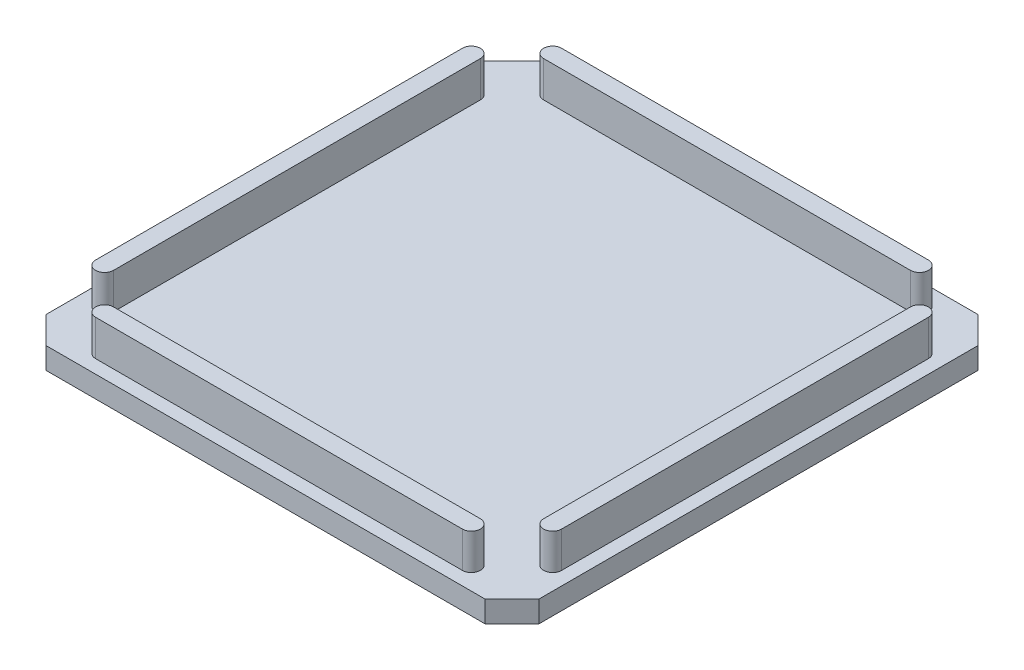
from build123d import *

# Parameters (mm, degrees)
BOSS_EXTRUDE1_DEPTH = 2.4
BOSS_EXTRUDE2_DEPTH = 4


with BuildPart() as part:
    # Sketch1 → Boss-Extrude1 (new body)
    with BuildSketch(Plane(origin=(0, 0, 0), x_dir=(1, 0, 0), z_dir=(0, 1, 0))):
        Polygon((-27.5, 24.5), (-24.5, 27.5), (24.5, 27.5), (27.5, 24.5), (27.5, -24.5), (24.5, -27.5), (-24.5, -27.5), (-27.5, -24.5), align=None)
    extrude(amount=BOSS_EXTRUDE1_DEPTH)

    # Sketch2 → Boss-Extrude2 (add)
    with BuildSketch(Plane(origin=(0, 2.4, 0), x_dir=(1, 0, 0), z_dir=(0, 1, 0))):
        with BuildLine():
            Line((-24, -20.465570271), (-24, 20.465570271))
            ThreePointArc((-24, 20.465570271), (-25, 21.465570271), (-26, 20.465570271))
            Line((-26, 20.465570271), (-26, -20.465570271))
            ThreePointArc((-26, -20.465570271), (-25, -21.465570271), (-24, -20.465570271))
        make_face()
        with BuildLine():
            Line((-20.465570271, 24), (20.465570271, 24))
            ThreePointArc((20.465570271, 24), (21.465570271, 25), (20.465570271, 26))
            Line((20.465570271, 26), (-20.465570271, 26))
            ThreePointArc((-20.465570271, 26), (-21.465570271, 25), (-20.465570271, 24))
        make_face()
        with BuildLine():
            Line((24, 20.465570271), (24, -20.465570271))
            ThreePointArc((24, -20.465570271), (25, -21.465570271), (26, -20.465570271))
            Line((26, -20.465570271), (26, 20.465570271))
            ThreePointArc((26, 20.465570271), (25, 21.465570271), (24, 20.465570271))
        make_face()
        with BuildLine():
            Line((20.465570271, -24), (-20.465570271, -24))
            ThreePointArc((-20.465570271, -24), (-21.465570271, -25), (-20.465570271, -26))
            Line((-20.465570271, -26), (20.465570271, -26))
            ThreePointArc((20.465570271, -26), (21.465570271, -25), (20.465570271, -24))
        make_face()
    extrude(amount=BOSS_EXTRUDE2_DEPTH)


solid = part.part
